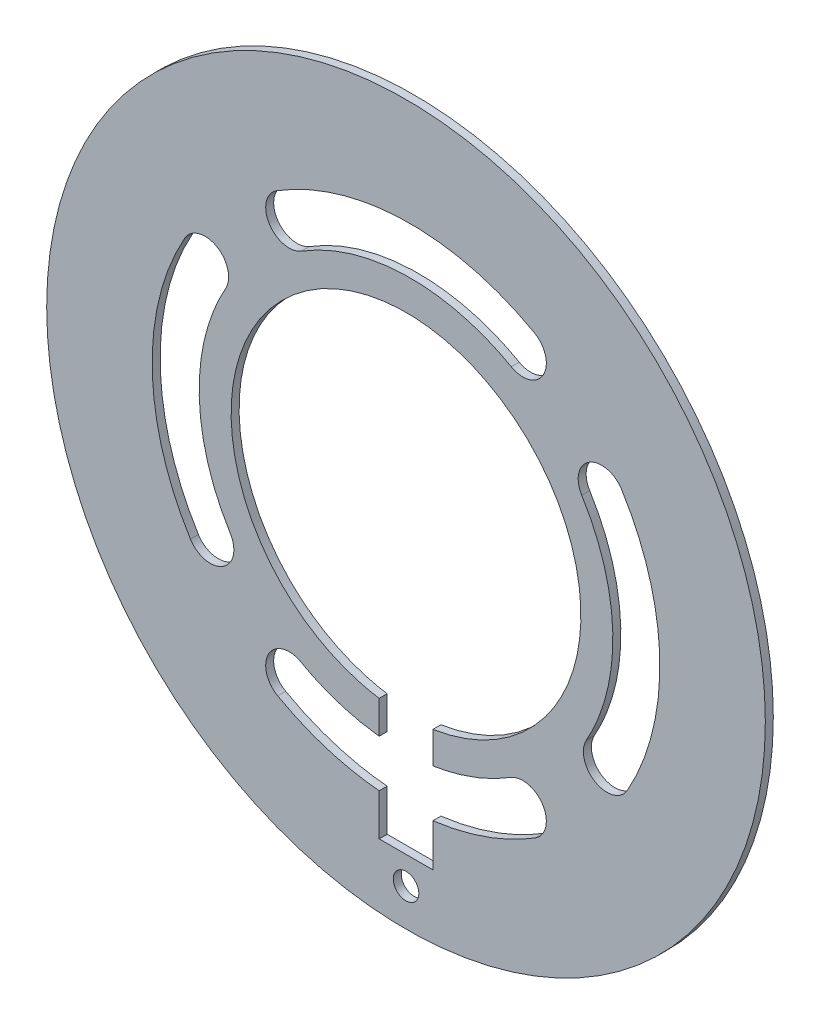
from build123d import *

# Parameters (mm, degrees)
MODEL_R             = 142.875
MODEL_R_2           = 5.08
BOSS_EXTRUDE1_DEPTH = 3.175


with BuildPart() as part:
    # Model → Boss-Extrude1 (new body)
    with BuildSketch(Plane.XY):
        with Locations((598.931529384, 540.028739073)):
            Circle(MODEL_R)
        with Locations((598.94473685, 411.99537176)):
            Circle(MODEL_R_2, mode=Mode.SUBTRACT)
        with BuildLine():
            Line((588.263058769, 439.49067885), (588.263058769, 432.46777176))
            Line((588.263058769, 432.46777176), (588.263058769, 422.94277176))
            Line((588.263058769, 422.94277176), (609.626414932, 422.94277176))
            Line((609.626414932, 422.94277176), (609.626414932, 432.46777176))
            Line((609.626414932, 432.46777176), (609.626414932, 439.869117325))
            add(Edge.make_bspline(
                [(609.626414932, 439.869117325), (624.076093151, 441.673413325), (637.961028614, 446.596503111), (650.319934945, 454.297549728)],
                knots=[0, 0, 0, 0, 1, 1, 1, 1], degree=3))
            add(Edge.make_bspline(
                [(650.319934945, 454.297549728), (654.699959233, 457.026818025), (656.038161369, 462.790038372), (650.579624776, 471.550086948), (644.816404429, 472.888289084), (640.436380141, 470.159020788)],
                knots=[0, 0, 0, 0, 1, 1, 2, 2, 2, 2], degree=3))
            add(Edge.make_bspline(
                [(609.626414932, 458.736713526), (620.563261609, 460.421069084), (631.044671662, 464.306886071), (640.436380141, 470.159020788)],
                knots=[0, 0, 0, 0, 1, 1, 1, 1], degree=3))
            Line((609.626414932, 458.736713526), (609.626414932, 471.326189462))
            add(Edge.make_bspline(
                [(609.626414932, 471.326189462), (647.569785357, 477.23281165), (673.540701185, 512.780254195), (661.727456807, 588.666995045), (626.180014262, 614.637910874), (550.293273412, 602.824666496), (524.322357584, 567.277223951), (530.228979773, 529.333853526), (534.884697336, 499.426131239), (558.353548704, 475.966301231), (588.263058769, 471.322082665)],
                knots=[0, 0, 0, 0, 1, 1, 2, 2, 3, 3, 3, 4, 4, 4, 4], degree=3))
            Line((588.263058769, 471.322082665), (588.263058769, 458.270419272))
            add(Edge.make_bspline(
                [(557.066987985, 468.290799115), (566.68347822, 462.880962168), (577.295001116, 459.472472333), (588.263058769, 458.270419272)],
                knots=[0, 0, 0, 0, 1, 1, 1, 1], degree=3))
            add(Edge.make_bspline(
                [(557.066987985, 468.290799115), (552.569101696, 470.821122636), (546.871611923, 469.226097865), (541.81096488, 460.230325286), (543.405989652, 454.532835513), (547.903875941, 452.002511992)],
                knots=[0, 0, 0, 0, 1, 1, 2, 2, 2, 2], degree=3))
            add(Edge.make_bspline(
                [(547.903875941, 452.002511992), (560.318178706, 445.018742224), (574.075306668, 440.753866736), (588.263058769, 439.49067885)],
                knots=[0, 0, 0, 0, 1, 1, 1, 1], degree=3))
        make_face(mode=Mode.SUBTRACT)
        with BuildLine():
            add(Edge.make_bspline(
                [(670.669823945, 498.164296946), (668.139500424, 493.666410656), (669.734525196, 487.968920884), (678.730297775, 482.908273841), (684.427787547, 484.503298612), (686.958111069, 489.001184902)],
                knots=[0, 0, 0, 0, 1, 1, 2, 2, 2, 2], degree=3))
            add(Edge.make_bspline(
                [(686.958111069, 489.001184902), (704.957293449, 520.996411982), (704.077427826, 560.260415411), (684.663073332, 591.417243905)],
                knots=[0, 0, 0, 0, 1, 1, 1, 1], degree=3))
            add(Edge.make_bspline(
                [(684.663073332, 591.417243905), (681.933805036, 595.797268193), (676.170584688, 597.135470329), (667.410536112, 591.676933737), (666.072333976, 585.913713389), (668.801602272, 581.533689101)],
                knots=[0, 0, 0, 0, 1, 1, 2, 2, 2, 2], degree=3))
            add(Edge.make_bspline(
                [(670.669823945, 498.164296946), (685.321636453, 524.209261568), (684.605402467, 556.171203195), (668.801602272, 581.533689101)],
                knots=[0, 0, 0, 0, 1, 1, 1, 1], degree=3))
        make_face(mode=Mode.SUBTRACT)
        with BuildLine():
            add(Edge.make_bspline(
                [(640.796326115, 611.767132906), (645.294212404, 609.236809385), (650.991702177, 610.831834156), (656.05234922, 619.827606735), (654.457324448, 625.525096508), (649.959438158, 628.055420029)],
                knots=[0, 0, 0, 0, 1, 1, 2, 2, 2, 2], degree=3))
            add(Edge.make_bspline(
                [(649.959438158, 628.055420029), (617.964211079, 646.05460241), (578.700207649, 645.174736787), (547.543379155, 625.760382293)],
                knots=[0, 0, 0, 0, 1, 1, 1, 1], degree=3))
            add(Edge.make_bspline(
                [(547.543379155, 625.760382293), (543.163354867, 623.031113996), (541.825152731, 617.267893649), (547.283689324, 608.507845073), (553.046909671, 607.169642937), (557.426933959, 609.898911233)],
                knots=[0, 0, 0, 0, 1, 1, 2, 2, 2, 2], degree=3))
            add(Edge.make_bspline(
                [(640.796326115, 611.767132906), (614.751361492, 626.418945414), (582.789419865, 625.702711428), (557.426933959, 609.898911233)],
                knots=[0, 0, 0, 0, 1, 1, 1, 1], degree=3))
        make_face(mode=Mode.SUBTRACT)
        with BuildLine():
            add(Edge.make_bspline(
                [(527.193490155, 581.893635075), (529.723813676, 586.391521365), (528.128788904, 592.089011137), (519.133016325, 597.14965818), (513.435526552, 595.554633409), (510.905203031, 591.056747119)],
                knots=[0, 0, 0, 0, 1, 1, 2, 2, 2, 2], degree=3))
            add(Edge.make_bspline(
                [(510.905203031, 591.056747119), (492.906020651, 559.061520039), (493.785886274, 519.79751661), (513.200240768, 488.640688116)],
                knots=[0, 0, 0, 0, 1, 1, 1, 1], degree=3))
            add(Edge.make_bspline(
                [(513.200240768, 488.640688116), (515.929509064, 484.260663827), (521.692729412, 482.922461692), (530.452777988, 488.380998284), (531.790980124, 494.144218632), (529.061711827, 498.52424292)],
                knots=[0, 0, 0, 0, 1, 1, 2, 2, 2, 2], degree=3))
            add(Edge.make_bspline(
                [(527.193490155, 581.893635075), (512.541677646, 555.848670453), (513.257911632, 523.886728826), (529.061711827, 498.52424292)],
                knots=[0, 0, 0, 0, 1, 1, 1, 1], degree=3))
        make_face(mode=Mode.SUBTRACT)
    extrude(amount=BOSS_EXTRUDE1_DEPTH)


solid = part.part
